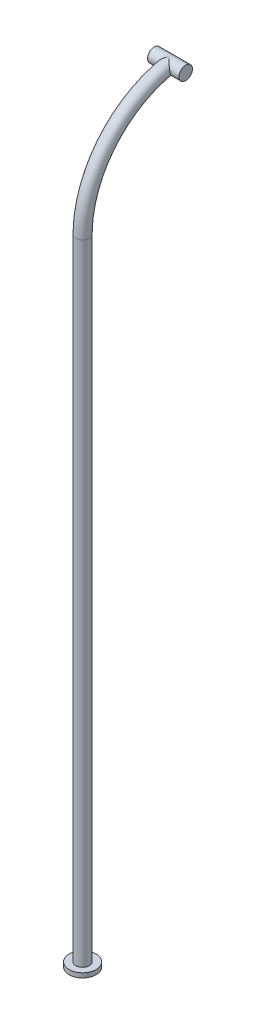
from build123d import *

# Parameters (mm, degrees)
SKETCH1_R                = 1.5
BOSS_EXTRUDE1_DEPTH      = 140
SKETCH4_R                = 3
BOSS_EXTRUDE4_DEPTH      = 1
SKETCH7_R                = 1.5000000000000002
REVOLVE1_ANGLE           = 80.00000000000017
BOSS_EXTRUDE5_DEPTH      = 3.5
BOSS_EXTRUDE5_DEPTH_BACK = 3.5
SKETCH8_R                = 1.5000000000000009


with BuildPart() as part:
    # Sketch1 → Boss-Extrude1 (new body)
    with BuildSketch(Plane(origin=(0, 0, 0), x_dir=(1, 0, 0), z_dir=(0, 1, 0))):
        Circle(SKETCH1_R)
    extrude(amount=BOSS_EXTRUDE1_DEPTH)

    # Sketch4 → Boss-Extrude4 (add)
    with BuildSketch(Plane.XZ):
        Circle(SKETCH4_R)
    extrude(amount=BOSS_EXTRUDE4_DEPTH)

    # Sketch7 → Revolve1 (revolve)
    with BuildSketch(Plane(origin=(0, 140, 0), x_dir=(1, 0, 0), z_dir=(0, 1, 0))):
        Circle(SKETCH7_R)
    revolve(axis=Axis((-42.51012264816653, 140, -23.499999999999993), (-1, 0, 8e-17)), revolution_arc=REVOLVE1_ANGLE)

    # Sketch8 → Boss-Extrude5 (add, two sides: drawn at the far end of the back side and taken through both)
    with BuildSketch(Plane(origin=(0, 0, 0), x_dir=(0, 0, -1), z_dir=(1, 0, 0)).offset(-BOSS_EXTRUDE5_DEPTH_BACK)):
        with Locations((19.419267824827195, 163.1429821957869)):
            Circle(SKETCH8_R)
    extrude(amount=BOSS_EXTRUDE5_DEPTH + BOSS_EXTRUDE5_DEPTH_BACK)


solid = part.part
